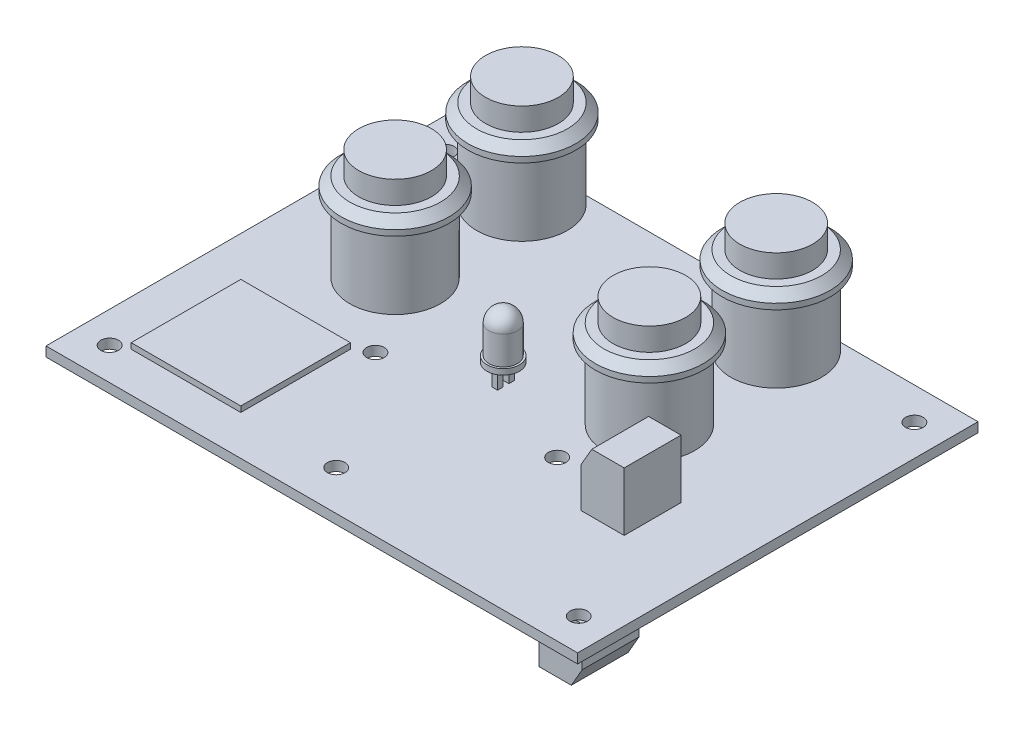
from build123d import *

# Parameters (mm, degrees)
CROQUIS1_W                 = 93.6
CROQUIS1_H                 = 70.5
SALIENTE_EXTRUIR1_DEPTH    = 1.7
SALIENTE_EXTRUIR2_START    = 5
CROQUIS2_W                 = 19.3
CROQUIS2_H                 = 19.3
SALIENTE_EXTRUIR2_DEPTH    = 1
CROQUIS3_W                 = 1
CROQUIS3_H                 = 1
SALIENTE_EXTRUIR3_DEPTH    = 5
SALIENTE_EXTRUIR3_2_DEPTH  = 5
SALIENTE_EXTRUIR3_3_DEPTH  = 5
SALIENTE_EXTRUIR4_START    = 3.3
CROQUIS4_R                 = 2.85
SALIENTE_EXTRUIR4_DEPTH    = 1
CROQUIS8_W                 = 1
CROQUIS8_H                 = 3.3
SALIENTE_EXTRUIR5_DEPTH    = 0.5
SALIENTE_EXTRUIR5_2_DEPTH  = 0.5
SALIENTE_EXTRUIR6_START    = 1.5
CROQUIS10_W                = 7.6
CROQUIS10_H                = 10
SALIENTE_EXTRUIR6_DEPTH    = 7
SALIENTE_EXTRUIR7_DEPTH    = 10
SALIENTE_EXTRUIR8_START    = -3.8
CROQUIS13_W                = 1
CROQUIS13_H                = 1.5
SALIENTE_EXTRUIR8_DEPTH    = 0.5
SALIENTE_EXTRUIR8_2_DEPTH  = 0.5
SALIENTE_EXTRUIR9_START    = 1.5
CROQUIS16_W                = 7.6
CROQUIS16_H                = 10
SALIENTE_EXTRUIR9_DEPTH    = 1
SALIENTE_EXTRUIR10_DEPTH   = 10
SALIENTE_EXTRUIR11_START   = -3.8
CROQUIS20_W                = 1
CROQUIS20_H                = 1.5
SALIENTE_EXTRUIR11_DEPTH   = 1
SALIENTE_EXTRUIR11_2_DEPTH = 1
SALIENTE_EXTRUIR12_START   = 4.2
CROQUIS21_R                = 8
SALIENTE_EXTRUIR12_DEPTH   = 13
SALIENTE_EXTRUIR12_2_DEPTH = 13
SALIENTE_EXTRUIR12_3_DEPTH = 13
SALIENTE_EXTRUIR12_4_DEPTH = 13
CROQUIS23_W                = 23.2
CROQUIS23_H                = 8.2
SALIENTE_EXTRUIR13_DEPTH   = 4
CHAFL_N1_SIZE              = 1.5
CROQUIS27_R                = 1.55
CORTAR_EXTRUIR1_DEPTH      = 62.563077408
CROQUIS29_R                = 9.5
SALIENTE_EXTRUIR14_DEPTH   = 2.5
CHAFL_N2_SIZE              = 1.5
CHAFL_N3_SIZE              = 1.5
CHAFL_N4_SIZE              = 1.5
CHAFL_N5_SIZE              = 1.5
CROQUIS30_R                = 6.4
SALIENTE_EXTRUIR15_DEPTH   = 4
SALIENTE_EXTRUIR15_2_DEPTH = 4
SALIENTE_EXTRUIR15_3_DEPTH = 4
SALIENTE_EXTRUIR15_4_DEPTH = 4


with BuildPart() as part:
    # Croquis1 → Saliente-Extruir1 (new body)
    with BuildSketch(Plane(origin=(0, 0, 0), x_dir=(1, 0, 0), z_dir=(0, 1, 0))):
        Rectangle(CROQUIS1_W, CROQUIS1_H)
    extrude(amount=SALIENTE_EXTRUIR1_DEPTH)

    # Croquis27 → Cortar-Extruir1 (cut, through all)
    with BuildSketch(Plane.XZ):
        with Locations(Location((-2.7, 28.25, 0), (0, 0, 270))):
            Circle(CROQUIS27_R)
        with Locations(Location((-16.8, 7.25, 0), (0, 0, 270))):
            Circle(CROQUIS27_R)
        with Locations(Location((15.2, 7.25, 0), (0, 0, 90))):
            Circle(CROQUIS27_R)
        with Locations(Location((-41.3, -29.55, 0), (0, 0, 270))):
            Circle(CROQUIS27_R)
        with Locations(Location((41.3, -29.55, 0), (0, 0, 90))):
            Circle(CROQUIS27_R)
        with Locations(Location((41.3, 29.55, 0), (0, 0, 270))):
            Circle(CROQUIS27_R)
        with Locations(Location((-41.3, 29.55, 0), (0, 0, 90))):
            Circle(CROQUIS27_R)
    extrude(amount=-CORTAR_EXTRUIR1_DEPTH, mode=Mode.SUBTRACT)


with BuildPart() as body_2:
    # Croquis2 → Saliente-Extruir2 (new body)
    with BuildSketch(Plane(origin=(0, 1.7, 0), x_dir=(1, 0, 0), z_dir=(0, 1, 0)).offset(SALIENTE_EXTRUIR2_START)):
        with Locations((-24.15, -23.6)):
            Rectangle(CROQUIS2_W, CROQUIS2_H)
    extrude(amount=SALIENTE_EXTRUIR2_DEPTH)


with BuildPart() as body_3:
    # Croquis3 → Saliente-Extruir3 (new body)
    with BuildSketch(Plane.XZ.offset(-6.7)):
        with Locations((-32.3, 25.6)):
            Rectangle(CROQUIS3_W, CROQUIS3_H)
    extrude(amount=SALIENTE_EXTRUIR3_DEPTH)


with BuildPart() as body_4:
    # Croquis3 → Saliente-Extruir3 2 (new body)
    with BuildSketch(Plane.XZ.offset(-6.7)):
        with Locations((-32.3, 23.6)):
            Rectangle(CROQUIS3_W, CROQUIS3_H)
    extrude(amount=SALIENTE_EXTRUIR3_2_DEPTH)


with BuildPart() as body_5:
    # Croquis3 → Saliente-Extruir3 3 (new body)
    with BuildSketch(Plane.XZ.offset(-6.7)):
        with Locations((-32.3, 21.6)):
            Rectangle(CROQUIS3_W, CROQUIS3_H)
    extrude(amount=SALIENTE_EXTRUIR3_3_DEPTH)


with BuildPart() as body_6:
    # Croquis4 → Saliente-Extruir4 (new body)
    with BuildSketch(Plane(origin=(0, 1.7, 0), x_dir=(1, 0, 0), z_dir=(0, 1, 0)).offset(SALIENTE_EXTRUIR4_START)):
        with Locations(Location((-0.8, -0.75, 0), (0, 0, 270))):
            Circle(CROQUIS4_R)
    extrude(amount=SALIENTE_EXTRUIR4_DEPTH)

    # Croquis7 → Revolución2 (revolve)
    with BuildSketch(Plane.ZY.offset(0.8)):
        with BuildLine():
            Line((0.75, 6), (-1.75, 6))
            Line((-1.75, 6), (-1.75, 11))
            ThreePointArc((-1.75, 11), (-1.017766953, 12.767766953), (0.75, 13.5))
            Line((0.75, 13.5), (0.75, 6))
        make_face()
    revolve(axis=Axis((-0.8, 6, 0.75), (0, 1, 0)))


with BuildPart() as body_7:
    # Croquis8 → Saliente-Extruir5 (new, symmetric)
    with BuildSketch(Plane.ZY.offset(0.8)):
        with Locations((-0.25, 3.35)):
            Rectangle(CROQUIS8_W, CROQUIS8_H)
    extrude(amount=SALIENTE_EXTRUIR5_DEPTH, both=True)


with BuildPart() as body_8:
    # Croquis8 → Saliente-Extruir5 2 (new, symmetric)
    with BuildSketch(Plane.ZY.offset(0.8)):
        with Locations((1.75, 3.35)):
            Rectangle(CROQUIS8_W, CROQUIS8_H)
    extrude(amount=SALIENTE_EXTRUIR5_2_DEPTH, both=True)


with BuildPart() as body_9:
    # Croquis10 → Saliente-Extruir6 (new body)
    with BuildSketch(Plane(origin=(0, 1.7, 0), x_dir=(1, 0, 0), z_dir=(0, 1, 0)).offset(SALIENTE_EXTRUIR6_START)):
        with Locations((30.7, -9.75)):
            Rectangle(CROQUIS10_W, CROQUIS10_H)
    extrude(amount=SALIENTE_EXTRUIR6_DEPTH)

    # Croquis12 → Saliente-Extruir7 (add)
    with BuildSketch(Plane.XY.offset(14.75)):
        Polygon((34.5, 10.2), (34.5, 13.5), (28.805255888, 13.5), (26.9, 10.2), align=None)
    extrude(amount=-SALIENTE_EXTRUIR7_DEPTH)


with BuildPart() as body_10:
    # Croquis13 → Saliente-Extruir8 (new, symmetric)
    with BuildSketch(Plane(origin=(34.5, 0, 0), x_dir=(0, 0, -1), z_dir=(1, 0, 0)).offset(SALIENTE_EXTRUIR8_START)):
        with Locations((-12.25, 2.45)):
            Rectangle(CROQUIS13_W, CROQUIS13_H)
    extrude(amount=SALIENTE_EXTRUIR8_DEPTH, both=True)


with BuildPart() as body_11:
    # Croquis13 → Saliente-Extruir8 2 (new, symmetric)
    with BuildSketch(Plane(origin=(34.5, 0, 0), x_dir=(0, 0, -1), z_dir=(1, 0, 0)).offset(SALIENTE_EXTRUIR8_START)):
        with Locations((-7.25, 2.45)):
            Rectangle(CROQUIS13_W, CROQUIS13_H)
    extrude(amount=SALIENTE_EXTRUIR8_2_DEPTH, both=True)


with BuildPart() as body_12:
    # Croquis16 → Saliente-Extruir9 (new body)
    with BuildSketch(Plane.XZ.offset(SALIENTE_EXTRUIR9_START)):
        with Locations((35.8, 22.25)):
            Rectangle(CROQUIS16_W, CROQUIS16_H)
    extrude(amount=SALIENTE_EXTRUIR9_DEPTH)

    # Croquis18 → Saliente-Extruir10 (add)
    with BuildSketch(Plane.XY.offset(27.25)):
        Polygon((39.6, -1.5), (39.6, -8.491782958), (37.69, -11.8), (32, -11.8), (32, -1.5), align=None)
    extrude(amount=-SALIENTE_EXTRUIR10_DEPTH)


with BuildPart() as body_13:
    # Croquis20 → Saliente-Extruir11 (new body)
    with BuildSketch(Plane(origin=(39.6, 0, 0), x_dir=(0, 0, -1), z_dir=(1, 0, 0)).offset(SALIENTE_EXTRUIR11_START)):
        with Locations((-24.75, -0.75)):
            Rectangle(CROQUIS20_W, CROQUIS20_H)
    extrude(amount=-SALIENTE_EXTRUIR11_DEPTH)


with BuildPart() as body_14:
    # Croquis20 → Saliente-Extruir11 2 (new body)
    with BuildSketch(Plane(origin=(39.6, 0, 0), x_dir=(0, 0, -1), z_dir=(1, 0, 0)).offset(SALIENTE_EXTRUIR11_START)):
        with Locations((-19.75, -0.75)):
            Rectangle(CROQUIS20_W, CROQUIS20_H)
    extrude(amount=-SALIENTE_EXTRUIR11_2_DEPTH)


with BuildPart() as body_15:
    # Croquis21 → Saliente-Extruir12 (new body)
    with BuildSketch(Plane(origin=(0, 1.7, 0), x_dir=(1, 0, 0), z_dir=(0, 1, 0)).offset(SALIENTE_EXTRUIR12_START)):
        with Locations(Location((-22.3, 24.05, 0), (0, 0, 90))):
            Circle(CROQUIS21_R)
    extrude(amount=SALIENTE_EXTRUIR12_DEPTH)



with BuildPart() as body_16:
    # Croquis21 → Saliente-Extruir12 2 (new body)
    with BuildSketch(Plane(origin=(0, 1.7, 0), x_dir=(1, 0, 0), z_dir=(0, 1, 0)).offset(SALIENTE_EXTRUIR12_START)):
        with Locations(Location((22.47, 24.05, 0), (0, 0, 90))):
            Circle(CROQUIS21_R)
    extrude(amount=SALIENTE_EXTRUIR12_2_DEPTH)


with BuildPart() as body_17:
    # Croquis21 → Saliente-Extruir12 3 (new body)
    with BuildSketch(Plane(origin=(0, 1.7, 0), x_dir=(1, 0, 0), z_dir=(0, 1, 0)).offset(SALIENTE_EXTRUIR12_START)):
        with Locations(Location((-22.3, 1.72, 0), (0, 0, 90))):
            Circle(CROQUIS21_R)
    extrude(amount=SALIENTE_EXTRUIR12_3_DEPTH)


with BuildPart() as body_18:
    # Croquis21 → Saliente-Extruir12 4 (new body)
    with BuildSketch(Plane(origin=(0, 1.7, 0), x_dir=(1, 0, 0), z_dir=(0, 1, 0)).offset(SALIENTE_EXTRUIR12_START)):
        with Locations(Location((22.47, 1.72, 0), (0, 0, 90))):
            Circle(CROQUIS21_R)
    extrude(amount=SALIENTE_EXTRUIR12_4_DEPTH)


with BuildPart() as body_19:
    # Croquis23 → Saliente-Extruir13 (new body)
    with BuildSketch(Plane.XZ):
        with Locations((0.023, -21.482)):
            Rectangle(CROQUIS23_W, CROQUIS23_H)
    extrude(amount=SALIENTE_EXTRUIR13_DEPTH)

    # Chaflán1
    chafl_n1_edges = [body_19.edges().sort_by_distance(p)[0] for p in [
        (-11.577, -4, -21.482),
        (0.023, -4, -25.582),
        (11.623, -4, -21.482),
        (0.023, -4, -17.382),
    ]]
    chamfer(chafl_n1_edges, length=CHAFL_N1_SIZE)


with BuildPart() as body_15_1:
    add(body_15.part)

    add(body_16.part)  # Saliente-Extruir14 merges body 16

    add(body_17.part)  # Saliente-Extruir14 merges body 17

    add(body_18.part)  # Saliente-Extruir14 merges body 18
    # Croquis29 → Saliente-Extruir14 (add)
    with BuildSketch(Plane(origin=(0, 18.9, 0), x_dir=(1, 0, 0), z_dir=(0, 1, 0))):
        with Locations(Location((-22.3, 24.05, 0), (0, 0, 270))):
            Circle(CROQUIS29_R)
        with Locations(Location((22.47, 24.05, 0), (0, 0, 270))):
            Circle(CROQUIS29_R)
        with Locations(Location((-22.3, 1.72, 0), (0, 0, 270))):
            Circle(CROQUIS29_R)
        with Locations(Location((22.47, 1.72, 0), (0, 0, 270))):
            Circle(CROQUIS29_R)
    extrude(amount=SALIENTE_EXTRUIR14_DEPTH)

    # Chaflán2
    chafl_n2_edges = [body_15_1.edges().sort_by_distance(p)[0] for p in [
        (-22.3, 21.4, -33.55),
    ]]
    chamfer(chafl_n2_edges, length=CHAFL_N2_SIZE)

    # Chaflán3
    chafl_n3_edges = [body_15_1.edges().sort_by_distance(p)[0] for p in [
        (-22.3, 21.4, -11.22),
    ]]
    chamfer(chafl_n3_edges, length=CHAFL_N3_SIZE)

    # Chaflán4
    chafl_n4_edges = [body_15_1.edges().sort_by_distance(p)[0] for p in [
        (22.47, 21.4, -33.55),
    ]]
    chamfer(chafl_n4_edges, length=CHAFL_N4_SIZE)

    # Chaflán5
    chafl_n5_edges = [body_15_1.edges().sort_by_distance(p)[0] for p in [
        (22.47, 21.4, -11.22),
    ]]
    chamfer(chafl_n5_edges, length=CHAFL_N5_SIZE)


with BuildPart() as body_17_2:
    # Croquis30 → Saliente-Extruir15 (new body)
    with BuildSketch(Plane(origin=(0, 21.4, 0), x_dir=(1, 0, 0), z_dir=(0, 1, 0))):
        with Locations(Location((-22.3, 24.05, 0), (0, 0, 270))):
            Circle(CROQUIS30_R)
    extrude(amount=SALIENTE_EXTRUIR15_DEPTH)


with BuildPart() as body_18_2:
    # Croquis30 → Saliente-Extruir15 2 (new body)
    with BuildSketch(Plane(origin=(0, 21.4, 0), x_dir=(1, 0, 0), z_dir=(0, 1, 0))):
        with Locations(Location((22.47, 24.05, 0), (0, 0, 270))):
            Circle(CROQUIS30_R)
    extrude(amount=SALIENTE_EXTRUIR15_2_DEPTH)


with BuildPart() as body_19_2:
    # Croquis30 → Saliente-Extruir15 3 (new body)
    with BuildSketch(Plane(origin=(0, 21.4, 0), x_dir=(1, 0, 0), z_dir=(0, 1, 0))):
        with Locations(Location((-22.3, 1.72, 0), (0, 0, 270))):
            Circle(CROQUIS30_R)
    extrude(amount=SALIENTE_EXTRUIR15_3_DEPTH)


with BuildPart() as body_20:
    # Croquis30 → Saliente-Extruir15 4 (new body)
    with BuildSketch(Plane(origin=(0, 21.4, 0), x_dir=(1, 0, 0), z_dir=(0, 1, 0))):
        with Locations(Location((22.47, 1.72, 0), (0, 0, 270))):
            Circle(CROQUIS30_R)
    extrude(amount=SALIENTE_EXTRUIR15_4_DEPTH)


solid = Compound([part.part, body_2.part, body_3.part, body_4.part, body_5.part, body_6.part, body_7.part, body_8.part, body_9.part, body_10.part, body_11.part, body_12.part, body_13.part, body_14.part, body_19.part, body_15_1.part, body_17_2.part, body_18_2.part, body_19_2.part, body_20.part])
